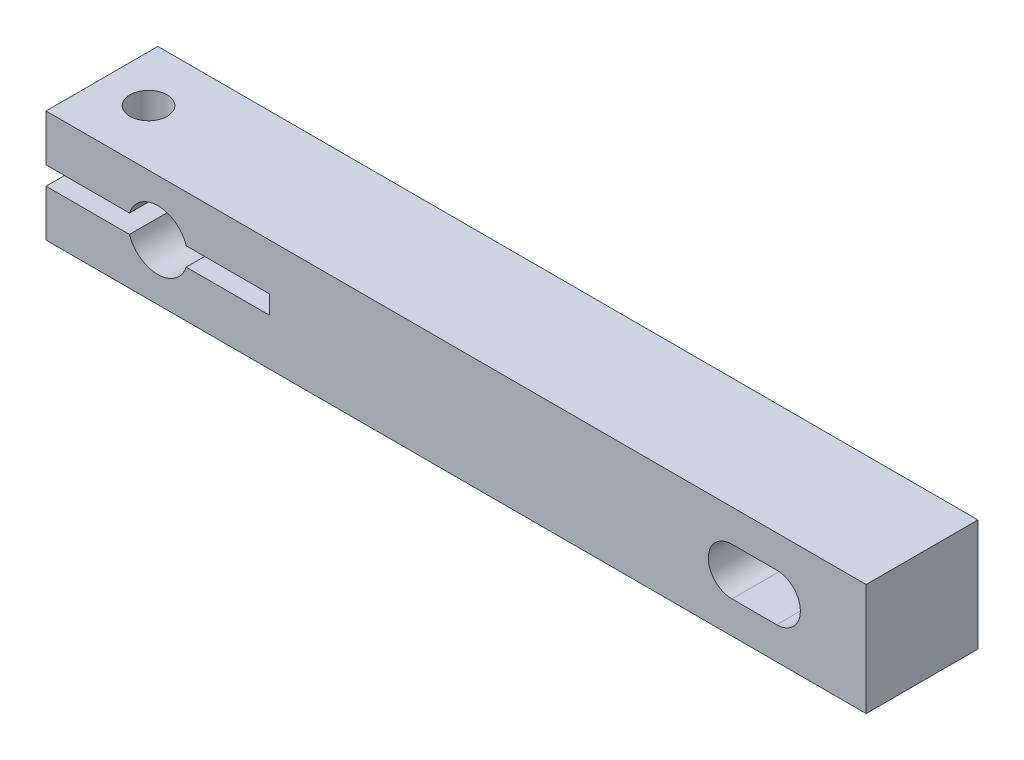
from build123d import *

# Parameters (mm, degrees)
CROQUIS1_W              = 15
CROQUIS1_H              = 15
SALIENTE_EXTRUIR1_DEPTH = 55
CORTAR_EXTRUIR1_DEPTH   = 58.5
CROQUIS3_R              = 2.5
CORTAR_EXTRUIR2_DEPTH   = 58.5
CORTAR_EXTRUIR3_DEPTH   = 58.5


with BuildPart() as part:
    # Croquis1 → Saliente-Extruir1 (new, symmetric)
    with BuildSketch(Plane(origin=(0, 0, 0), x_dir=(0, 0, -1), z_dir=(1, 0, 0))):
        Rectangle(CROQUIS1_W, CROQUIS1_H)
    extrude(amount=SALIENTE_EXTRUIR1_DEPTH, both=True)

    # Croquis2 → Cortar-Extruir1 (cut, through all)
    with BuildSketch(Plane.XY.offset(7.5)):
        with BuildLine():
            ThreePointArc((-43.802977877, -1.239902926), (-40, -4), (-36.197022123, -1.239902926))
            Line((-36.197022123, -1.239902926), (-43.802977877, -1.239902926))
        make_face()
        with BuildLine():
            Line((-43.802977877, -1.239902926), (-36.197022123, -1.239902926))
            ThreePointArc((-36.197022123, -1.239902926), (-36.049562587, -0.627729437), (-36, 0))
            ThreePointArc((-36, 0), (-36.049562587, 0.627729437), (-36.197022123, 1.239902926))
            Line((-36.197022123, 1.239902926), (-43.802977877, 1.239902926))
            ThreePointArc((-43.802977877, 1.239902926), (-44, 0), (-43.802977877, -1.239902926))
        make_face()
        with BuildLine():
            Line((-43.802977877, 1.239902926), (-36.197022123, 1.239902926))
            ThreePointArc((-36.197022123, 1.239902926), (-40, 4), (-43.802977877, 1.239902926))
        make_face()
        with BuildLine():
            Line((-36.197022123, -1.239902926), (-25, -1.239902926))
            Line((-25, -1.239902926), (-25, 1.239902926))
            Line((-25, 1.239902926), (-36.197022123, 1.239902926))
            ThreePointArc((-36.197022123, 1.239902926), (-36.049562587, 0.627729437), (-36, 0))
            ThreePointArc((-36, 0), (-36.049562587, -0.627729437), (-36.197022123, -1.239902926))
        make_face()
        with BuildLine():
            Line((-55, -1.239902926), (-43.802977877, -1.239902926))
            ThreePointArc((-43.802977877, -1.239902926), (-44, 0), (-43.802977877, 1.239902926))
            Line((-43.802977877, 1.239902926), (-55, 1.239902926))
            Line((-55, 1.239902926), (-55, -1.239902926))
        make_face()
    extrude(amount=-CORTAR_EXTRUIR1_DEPTH, mode=Mode.SUBTRACT)

    # Croquis3 → Cortar-Extruir2 (cut, through all)
    with BuildSketch(Plane(origin=(0, 7.5, 0), x_dir=(1, 0, 0), z_dir=(0, 1, 0))):
        with Locations(Location((-48.75, 0, 0), (0, 0, 270))):
            Circle(CROQUIS3_R)
    extrude(amount=-CORTAR_EXTRUIR2_DEPTH, mode=Mode.SUBTRACT)

    # Croquis4 → Cortar-Extruir3 (cut, through all)
    with BuildSketch(Plane.XY.offset(7.5)):
        with BuildLine():
            Line((37, 3.175), (43, 3.175))
            ThreePointArc((43, 3.175), (46.175, 0), (43, -3.175))
            Line((43, -3.175), (37, -3.175))
            ThreePointArc((37, -3.175), (33.825, 0), (37, 3.175))
        make_face()
    extrude(amount=-CORTAR_EXTRUIR3_DEPTH, mode=Mode.SUBTRACT)


solid = part.part
